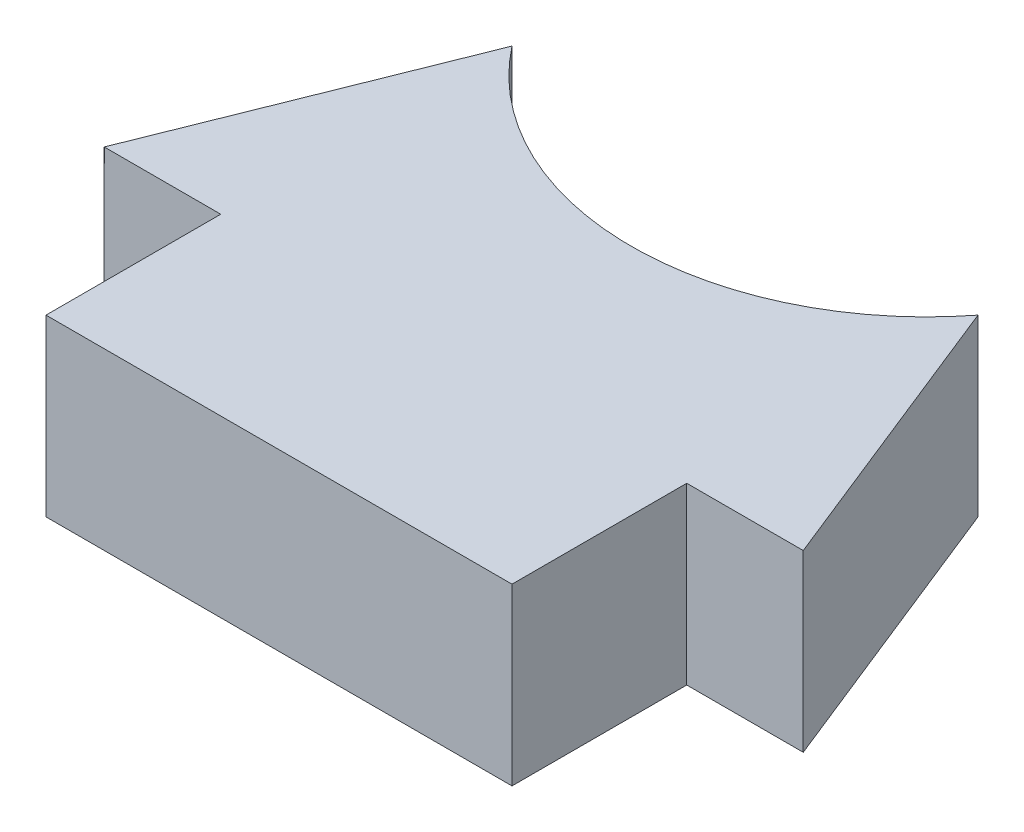
from build123d import *

# Parameters (mm, degrees)
RESSALTO_EXTRUS_O1_DEPTH = 3


with BuildPart() as part:
    # Esboço1 → Ressalto-extrusão1 (new body)
    with BuildSketch(Plane(origin=(0, 0, 0), x_dir=(1, 0, 0), z_dir=(0, 1, 0))):
        with BuildLine():
            Line((-12.832180901, -16.753564618), (-4.832180901, -16.753564618))
            Line((-4.832180901, -16.753564618), (-4.832180901, -13.753564618))
            Line((-4.832180901, -13.753564618), (-2.832180901, -13.753564618))
            Line((-2.832180901, -13.753564618), (-4.832180901, -8.753564618))
            ThreePointArc((-4.832180901, -8.753564618), (-8.832180901, -10.707193571), (-12.832180901, -8.753564618))
            Line((-12.832180901, -8.753564618), (-14.832180901, -13.753564618))
            Line((-14.832180901, -13.753564618), (-12.832180901, -13.753564618))
            Line((-12.832180901, -13.753564618), (-12.832180901, -16.753564618))
        make_face()
    extrude(amount=RESSALTO_EXTRUS_O1_DEPTH)


solid = part.part
